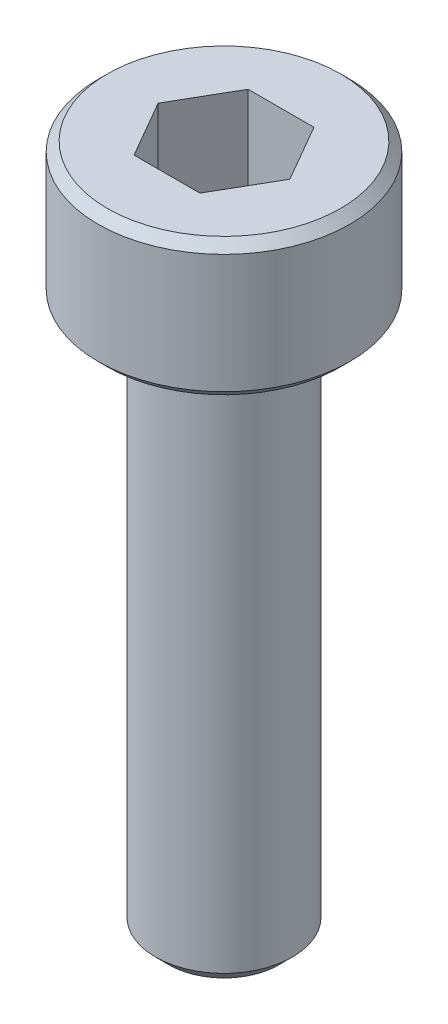
from build123d import *

# Parameters (mm, degrees)
CHAMFER_1_SIZE      = 0.2
CHAMFER_2_SIZE      = 0.3
CUT_EXTRUDE_1_DEPTH = 2.5


with BuildPart() as part:
    # 草图1 → 旋转1 (revolve)
    with BuildSketch(Plane.XY, mode=Mode.PRIVATE) as revolve_1_sk:
        Polygon((1.5, 0), (2.75, 0), (2.75, 3), (0, 3), (0, 0), (0, -12), (1.5, -12), align=None)
    revolve(revolve_1_sk.sketch.rotate(Axis((0, 3, 0), (0, -1, 0)), 90), axis=Axis((0, 3, 0), (0, -1, 0)))

    # 倒角1
    chamfer_1_edges = [part.edges().sort_by_distance(p)[0] for p in [
        (0, 3, -2.75),
        (0, 0, -2.75),
    ]]
    chamfer(chamfer_1_edges, length=CHAMFER_1_SIZE)

    # 倒角2
    chamfer_2_edges = [part.edges().sort_by_distance(p)[0] for p in [
        (0, -12, -1.5),
    ]]
    chamfer(chamfer_2_edges, length=CHAMFER_2_SIZE)

    # 草图2 → 切除-拉伸1 (cut)
    with BuildSketch(Plane(origin=(0, 3, 0), x_dir=(1, 0, 0), z_dir=(0, 1, 0))):
        Polygon((-0.72, 1.247076581), (0.72, 1.247076581), (1.44, 0), (0.72, -1.247076581), (-0.72, -1.247076581), (-1.44, 0), align=None)
    extrude(amount=-CUT_EXTRUDE_1_DEPTH, mode=Mode.SUBTRACT)


solid = part.part
